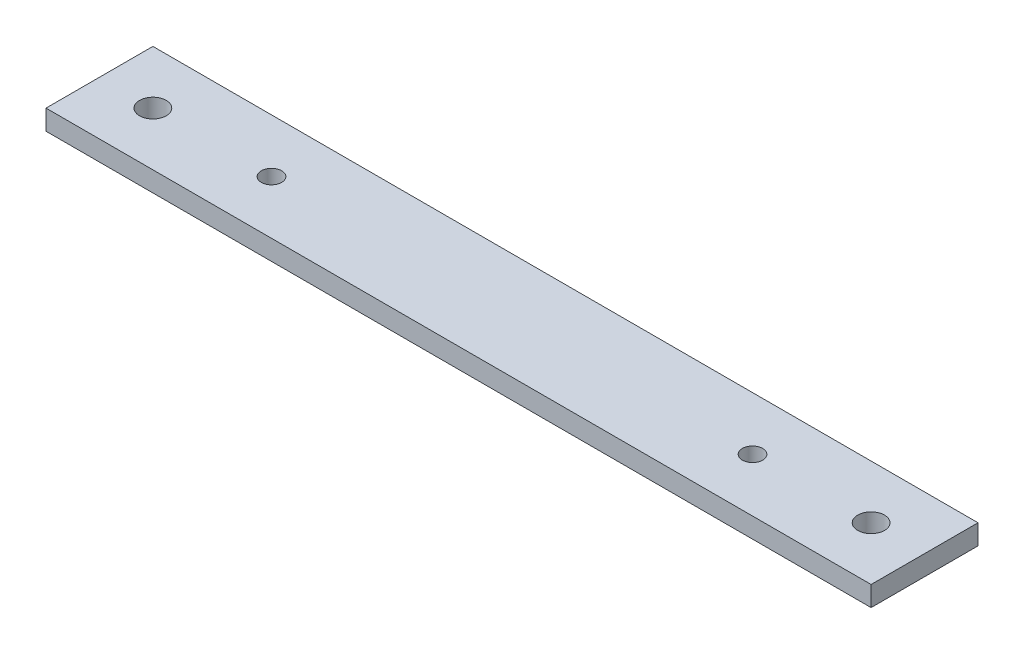
from build123d import *

# Parameters (mm, degrees)
SKETCH1_W           = 196.0626
SKETCH1_H           = 25.4
BOSS_EXTRUDE1_DEPTH = 4.7625
SKETCH2_R           = 2.413
SKETCH2_R_2         = 3.175
CUT_EXTRUDE1_DEPTH  = 99.965181685


with BuildPart() as part:
    # Sketch1 → Boss-Extrude1 (new body)
    with BuildSketch(Plane(origin=(0, 0, 0), x_dir=(1, 0, 0), z_dir=(0, 1, 0))):
        Rectangle(SKETCH1_W, SKETCH1_H)
    extrude(amount=BOSS_EXTRUDE1_DEPTH)

    # Sketch2 → Cut-Extrude1 (cut, through all)
    with BuildSketch(Plane(origin=(0, 4.7625, 0), x_dir=(1, 0, 0), z_dir=(0, 1, 0))):
        with Locations(Location((-57.15, 0, 0), (0, 0, 270))):
            Circle(SKETCH2_R)
        with Locations(Location((57.15, 0, 0), (0, 0, 270))):
            Circle(SKETCH2_R)
        with Locations(Location((-85.3313, 0, 0), (0, 0, 270))):
            Circle(SKETCH2_R_2)
        with Locations(Location((85.3313, 0, 0), (0, 0, 270))):
            Circle(SKETCH2_R_2)
    extrude(amount=-CUT_EXTRUDE1_DEPTH, mode=Mode.SUBTRACT)


solid = part.part
